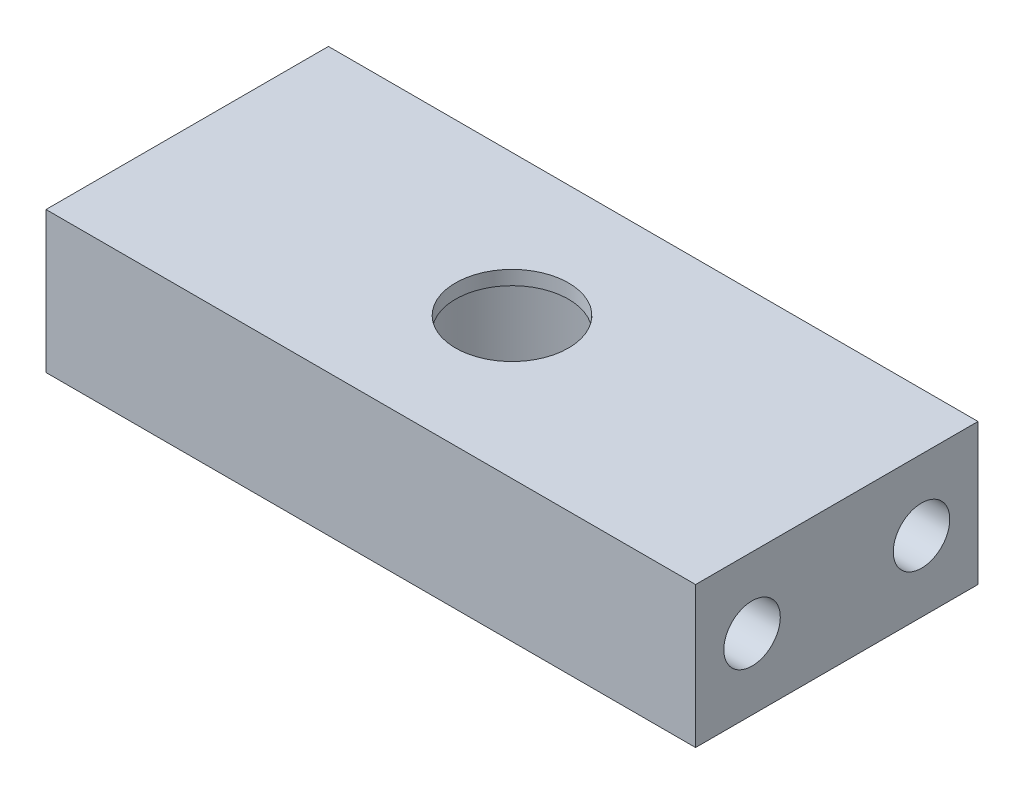
from build123d import *

# Parameters (mm, degrees)
BOSS_EXTRUDE1_DEPTH      = 88.9
CUT_EXTRUDE2_DEPTH       = 241.232341963
CUT_EXTRUDE2_DEPTH_BACK  = 241.232341963
SKETCH3_R                = 28.575
CUT_EXTRUDE5_DEPTH       = 28.575
CUT_EXTRUDE6_DEPTH       = 243.134084755
CUT_EXTRUDE6_DEPTH_BACK  = 243.134084755
SKETCH4_R                = 12.7
CUT_EXTRUDE7_DEPTH       = 261.369359036
CUT_EXTRUDE7_DEPTH_BACK  = 261.369359036
CUT_EXTRUDE8_DEPTH       = 261.369359036
CUT_EXTRUDE8_DEPTH_BACK  = 12.7
SKETCH6_R                = 9.525
SKETCH7_R                = 6.35
CUT_EXTRUDE9_DEPTH       = 12.7
SKETCH12_R               = 12.7
CUT_EXTRUDE13_DEPTH      = 3.175
CUT_EXTRUDE14_DEPTH      = 253.187753717
CUT_EXTRUDE14_DEPTH_BACK = 253.187753717
SKETCH14_R               = 1.5875
CUT_EXTRUDE15_START      = -12.7
CUT_EXTRUDE15_DEPTH      = 12.7
CUT_EXTRUDE16_START      = -12.7
SKETCH8_4_R              = 6.35
CUT_EXTRUDE16_DEPTH      = 19.05
CUT_EXTRUDE18_START      = -171.45
CUT_EXTRUDE18_DEPTH      = 12.7
CUT_EXTRUDE19_START      = -139.7
SKETCH8_10_R             = 6.35
CUT_EXTRUDE19_DEPTH      = 19.05
SKETCH15_R               = 6.35
CUT_EXTRUDE20_DEPTH      = 19.05
CHAMFER1_SIZE            = 2


with BuildPart() as part:
    # Sketch1 → Boss-Extrude1 (new body)
    with BuildSketch(Plane.XY):
        Polygon((0, 0), (0, -174.625), (171.45, -174.625), (171.45, 0), (158.75, 0), (158.75, -142.875), (12.7, -142.875), (12.7, 0), align=None)
    extrude(amount=BOSS_EXTRUDE1_DEPTH)

    # Sketch2 → Cut-Extrude2 (cut, two sides: drawn at the far end of the back side and taken through both)
    with BuildSketch(Plane(origin=(0, -142.875, 0), x_dir=(1, 0, 0), z_dir=(0, 1, 0)).offset(-CUT_EXTRUDE2_DEPTH_BACK)):
        Polygon((158.75, 0), (12.7, 0), (12.7, -25.4), (85.724999876, -25.4), (158.75, -25.4), align=None)
    extrude(amount=CUT_EXTRUDE2_DEPTH + CUT_EXTRUDE2_DEPTH_BACK, mode=Mode.SUBTRACT)

    # Sketch3 → Cut-Extrude5 (cut)
    with BuildSketch(Plane.XZ.offset(174.625)):
        with Locations((85.725, 57.15)):
            Circle(SKETCH3_R)
    extrude(amount=-CUT_EXTRUDE5_DEPTH, mode=Mode.SUBTRACT)

    # Sketch4 → Cut-Extrude6 (cut, two sides: drawn at the far end of the back side and taken through both)
    with BuildSketch(Plane.XZ.offset(146.05).offset(-CUT_EXTRUDE6_DEPTH_BACK)):
        with Locations((85.725, 57.15)):
            Circle(SKETCH4_R)
    extrude(amount=CUT_EXTRUDE6_DEPTH + CUT_EXTRUDE6_DEPTH_BACK, mode=Mode.SUBTRACT)

    # Sketch5 → Cut-Extrude7 (cut, two sides: drawn at the far end of the back side and taken through both)
    with BuildSketch(Plane(origin=(171.45, 0, 0), x_dir=(0, 0, -1), z_dir=(1, 0, 0)).offset(-CUT_EXTRUDE7_DEPTH_BACK)):
        with BuildLine():
            Line((0, -174.625), (0, -114.3))
            ThreePointArc((0, -114.3), (-0.597344099, -119.776153781), (-2.361280333, -124.994736842))
            Line((-2.361280333, -124.994736842), (-25.4, -174.625))
            Line((-25.4, -174.625), (0, -174.625))
        make_face()
        with BuildLine():
            Line((-39.269490456, -98.025866748), (-71.745289975, -22.119448379))
            ThreePointArc((-71.745289975, -22.119448379), (-70.400400796, -7.131859618), (-57.149999966, 0))
            Line((-57.149999966, 0), (-88.9, 0))
            Line((-88.9, 0), (-88.9, -142.875))
            Line((-88.9, -142.875), (-50.8, -142.875))
            Line((-50.8, -142.875), (-39.583234749, -118.711720996))
            ThreePointArc((-39.583234749, -118.711720996), (-37.224875429, -108.402184034), (-39.269490456, -98.025866748))
        make_face()
        with BuildLine():
            Line((0, 0), (-57.149999966, 0))
            ThreePointArc((-57.149999966, 0), (-48.406859618, -2.624599204), (-42.554710025, -9.630551621))
            Line((-42.554710025, -9.630551621), (-2.047536041, -104.308882594))
            ThreePointArc((-2.047536041, -104.308882594), (-0.51714863, -109.200616928), (0, -114.3))
            Line((0, -114.3), (0, 0))
        make_face()
    extrude(amount=CUT_EXTRUDE7_DEPTH + CUT_EXTRUDE7_DEPTH_BACK, mode=Mode.SUBTRACT)

    # Sketch6 → Cut-Extrude8 (cut, two sides: drawn at the far end of the back side and taken through both)
    with BuildSketch(Plane(origin=(171.45, 0, 0), x_dir=(0, 0, -1), z_dir=(1, 0, 0)).offset(-CUT_EXTRUDE8_DEPTH_BACK)):
        with Locations(Location((-57.15, -15.875, 0), (0, 0, 90))):
            Circle(SKETCH6_R)
    extrude(amount=CUT_EXTRUDE8_DEPTH + CUT_EXTRUDE8_DEPTH_BACK, mode=Mode.SUBTRACT)

    # Sketch7 → Cut-Extrude9 (cut)
    with BuildSketch(Plane(origin=(12.7, 0, 0), x_dir=(0, 0, -1), z_dir=(1, 0, 0))):
        with Locations((-57.15, -15.875)):
            Circle(SKETCH7_R)
    extrude(amount=-CUT_EXTRUDE9_DEPTH, mode=Mode.SUBTRACT)

    # Sketch12 → Cut-Extrude13 (cut)
    with BuildSketch(Plane(origin=(12.7, 0, 0), x_dir=(0, 0, -1), z_dir=(1, 0, 0))):
        with Locations((-57.15, -15.875)):
            Circle(SKETCH12_R)
    extrude(amount=-CUT_EXTRUDE13_DEPTH, mode=Mode.SUBTRACT)

    # Sketch14 → Cut-Extrude14 (cut, two sides: drawn at the far end of the back side and taken through both)
    with BuildSketch(Plane(origin=(12.7, 0, 0), x_dir=(0, 0, -1), z_dir=(1, 0, 0)).offset(-CUT_EXTRUDE14_DEPTH_BACK)):
        with Locations((-53.770765225, -24.780413934)):
            Circle(SKETCH14_R)
        with Locations((-66.551932086, -14.348796194)):
            Circle(SKETCH14_R)
        with Locations((-51.12730269, -8.495789872)):
            Circle(SKETCH14_R)
    extrude(amount=CUT_EXTRUDE14_DEPTH + CUT_EXTRUDE14_DEPTH_BACK, mode=Mode.SUBTRACT)

    # Sketch8 → Cut-Extrude15 (cut)
    with BuildSketch(Plane(origin=(171.45, 0, 0), x_dir=(0, 0, -1), z_dir=(1, 0, 0)).offset(CUT_EXTRUDE15_START)):
        with BuildLine():
            Line((-50.8, -142.875), (-88.9, -142.875))
            Line((-88.9, -142.875), (-88.9, -174.625))
            Line((-88.9, -174.625), (-25.4, -174.625))
            Line((-25.4, -174.625), (-2.361280333, -124.994736842))
            ThreePointArc((-2.361280333, -124.994736842), (-0.002921013, -114.68519988), (-2.047536041, -104.308882594))
            Line((-2.047536041, -104.308882594), (-42.554710025, -9.630551621))
            ThreePointArc((-42.554710025, -9.630551621), (-63.394448379, -1.279710025), (-71.745289975, -22.119448379))
            Line((-71.745289975, -22.119448379), (-39.269490456, -98.025866748))
            ThreePointArc((-39.269490456, -98.025866748), (-37.224875429, -108.402184034), (-39.583234749, -118.711720996))
            Line((-39.583234749, -118.711720996), (-50.8, -142.875))
        make_face()
    extrude(amount=CUT_EXTRUDE15_DEPTH, mode=Mode.SUBTRACT)

    # Sketch8<4> → Cut-Extrude16 (cut)
    with BuildSketch(Plane(origin=(171.45, 0, 0), x_dir=(0, 0, -1), z_dir=(1, 0, 0)).offset(CUT_EXTRUDE16_START)):
        with Locations(Location((-76.2, -158.75, 0), (0, 0, 90))):
            Circle(SKETCH8_4_R)
        with Locations(Location((-38.1, -158.75, 0), (0, 0, 90))):
            Circle(SKETCH8_4_R)
    extrude(amount=-CUT_EXTRUDE16_DEPTH, mode=Mode.SUBTRACT)

    # Sketch8<9> → Cut-Extrude18 (cut)
    with BuildSketch(Plane(origin=(171.45, 0, 0), x_dir=(0, 0, -1), z_dir=(1, 0, 0)).offset(CUT_EXTRUDE18_START)):
        with BuildLine():
            Line((-50.8, -142.875), (-88.9, -142.875))
            Line((-88.9, -142.875), (-88.9, -174.625))
            Line((-88.9, -174.625), (-25.4, -174.625))
            Line((-25.4, -174.625), (-2.361280333, -124.994736842))
            ThreePointArc((-2.361280333, -124.994736842), (-0.002921013, -114.68519988), (-2.047536041, -104.308882594))
            Line((-2.047536041, -104.308882594), (-42.554710025, -9.630551621))
            ThreePointArc((-42.554710025, -9.630551621), (-63.394448379, -1.279710025), (-71.745289975, -22.119448379))
            Line((-71.745289975, -22.119448379), (-39.269490456, -98.025866748))
            ThreePointArc((-39.269490456, -98.025866748), (-37.224875429, -108.402184034), (-39.583234749, -118.711720996))
            Line((-39.583234749, -118.711720996), (-50.8, -142.875))
        make_face()
    extrude(amount=CUT_EXTRUDE18_DEPTH, mode=Mode.SUBTRACT)

    # Sketch8<10> → Cut-Extrude19 (cut)
    with BuildSketch(Plane(origin=(171.45, 0, 0), x_dir=(0, 0, -1), z_dir=(1, 0, 0)).offset(CUT_EXTRUDE19_START)):
        with Locations(Location((-76.2, -158.75, 0), (0, 0, 90))):
            Circle(SKETCH8_10_R)
        with Locations(Location((-38.1, -158.75, 0), (0, 0, 90))):
            Circle(SKETCH8_10_R)
    extrude(amount=-CUT_EXTRUDE19_DEPTH, mode=Mode.SUBTRACT)

    # Sketch15 → Cut-Extrude20 (cut)
    with BuildSketch(Plane.XZ.offset(174.625)):
        with Locations((140.97, 73.025)):
            Circle(SKETCH15_R)
        with Locations((140.97, 41.275)):
            Circle(SKETCH15_R)
    extrude(amount=-CUT_EXTRUDE20_DEPTH, mode=Mode.SUBTRACT)

    # Chamfer1
    chamfer1_edges = [part.edges().sort_by_distance(p)[0] for p in [
        (57.15, -174.625, 57.15),
    ]]
    chamfer(chamfer1_edges, length=CHAMFER1_SIZE)


solid = part.part
